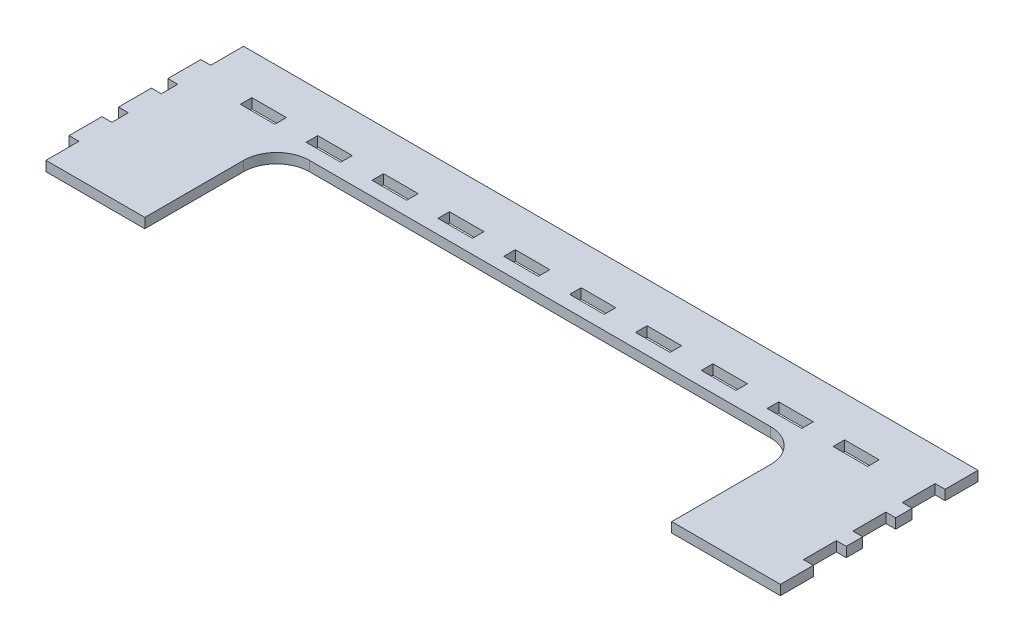
from build123d import *

# Parameters (mm, degrees)
EXTRUDE_1_DEPTH     = 3
SKETCH_2_W          = 10.5
SKETCH_2_H          = 3.5
CUT_EXTRUDE_1_DEPTH = 150.258104234


with BuildPart() as part:
    # Эскиз1 → Бобышка-Вытянуть1 (new body)
    with BuildSketch(Plane(origin=(0, 0, 0), x_dir=(1, 0, 0), z_dir=(0, 1, 0))):
        with BuildLine():
            Line((-135, -31.788922156), (-138, -31.788922156))
            Line((-138, -31.788922156), (-138, -21.788922156))
            Line((-138, -21.788922156), (-135, -21.788922156))
            Line((-135, -21.788922156), (-135, -16.788922156))
            Line((-135, -16.788922156), (-138, -16.788922156))
            Line((-138, -16.788922156), (-138, -6.788922156))
            Line((-138, -6.788922156), (-135, -6.788922156))
            Line((-135, -6.788922156), (-135, 3.211077844))
            Line((-135, 3.211077844), (-125, 3.211077844))
            Line((-125, 3.211077844), (75, 3.211077844))
            Line((75, 3.211077844), (85, 3.211077844))
            Line((85, 3.211077844), (88, 3.211077844))
            Line((88, 3.211077844), (88, -6.788922156))
            Line((88, -6.788922156), (85, -6.788922156))
            Line((85, -6.788922156), (85, -16.788922156))
            Line((85, -16.788922156), (88, -16.788922156))
            Line((88, -16.788922156), (88, -21.788922156))
            Line((88, -21.788922156), (85, -21.788922156))
            Line((85, -21.788922156), (85, -31.788922156))
            Line((85, -31.788922156), (88, -31.788922156))
            Line((88, -31.788922156), (88, -36.788922156))
            Line((88, -36.788922156), (85, -36.788922156))
            Line((85, -36.788922156), (85, -46.788922156))
            Line((85, -46.788922156), (88, -46.788922156))
            Line((88, -46.788922156), (88, -56.788922156))
            Line((88, -56.788922156), (85, -56.788922156))
            Line((85, -56.788922156), (55, -56.788922156))
            Line((55, -56.788922156), (55, -26.788922156))
            ThreePointArc((55, -26.788922156), (52.071067812, -19.717854344), (45, -16.788922156))
            Line((45, -16.788922156), (-95, -16.788922156))
            ThreePointArc((-95, -16.788922156), (-102.071067812, -19.717854344), (-105, -26.788922156))
            Line((-105, -26.788922156), (-105, -56.788922156))
            Line((-105, -56.788922156), (-135, -56.788922156))
            Line((-135, -56.788922156), (-135, -46.788922156))
            Line((-135, -46.788922156), (-138, -46.788922156))
            Line((-138, -46.788922156), (-138, -36.788922156))
            Line((-138, -36.788922156), (-135, -36.788922156))
            Line((-135, -36.788922156), (-135, -31.788922156))
        make_face()
    extrude(amount=EXTRUDE_1_DEPTH)

    # Эскиз2 → Вырез-Вытянуть1 (cut, through all)
    with BuildSketch(Plane(origin=(0, 0, 0), x_dir=(1, 0, 0), z_dir=(0, 1, 0))):
        with Locations((-115, -10.788922156)):
            Rectangle(SKETCH_2_W, SKETCH_2_H)
        with Locations((-95, -10.788922156)):
            Rectangle(SKETCH_2_W, SKETCH_2_H)
        with Locations((-75, -10.788922156)):
            Rectangle(SKETCH_2_W, SKETCH_2_H)
        with Locations((-55, -10.788922156)):
            Rectangle(SKETCH_2_W, SKETCH_2_H)
        with Locations((-35, -10.788922156)):
            Rectangle(SKETCH_2_W, SKETCH_2_H)
        with Locations((-15, -10.788922156)):
            Rectangle(SKETCH_2_W, SKETCH_2_H)
        with Locations((5, -10.788922156)):
            Rectangle(SKETCH_2_W, SKETCH_2_H)
        with Locations((25, -10.788922156)):
            Rectangle(SKETCH_2_W, SKETCH_2_H)
        with Locations((45, -10.788922156)):
            Rectangle(SKETCH_2_W, SKETCH_2_H)
        with Locations((65, -10.788922156)):
            Rectangle(SKETCH_2_W, SKETCH_2_H)
    extrude(amount=CUT_EXTRUDE_1_DEPTH, mode=Mode.SUBTRACT)


solid = part.part
